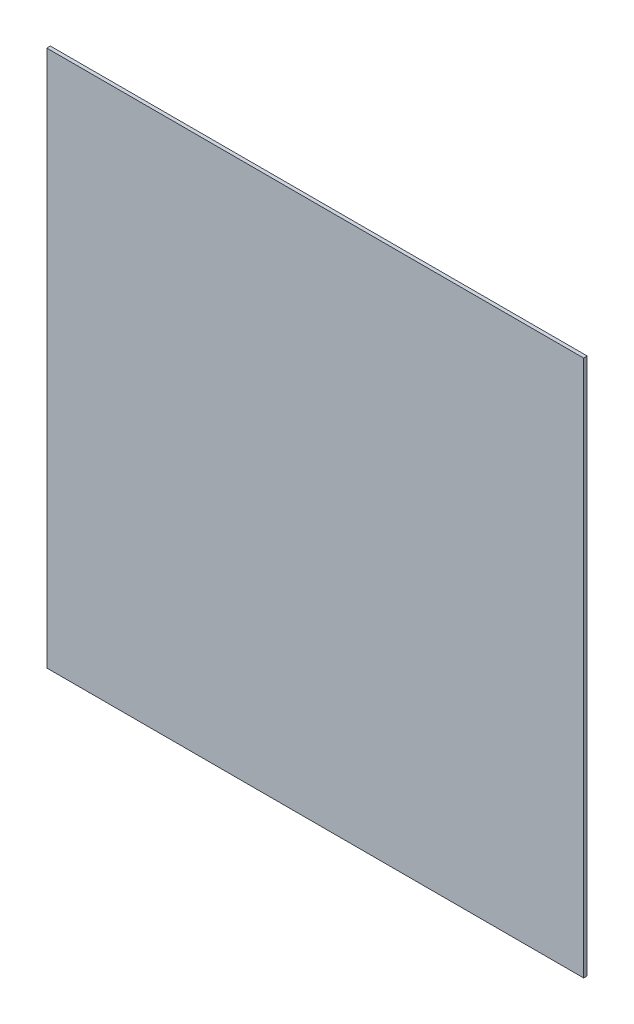
from build123d import *

# Parameters (mm, degrees)
SKETCH_1_W      = 150
SKETCH_1_H      = 150
EXTRUDE_1_DEPTH = 1


with BuildPart() as part:
    # Эскиз1 → Бобышка-Вытянуть1 (new body)
    with BuildSketch(Plane.XY):
        with Locations((75, 75)):
            Rectangle(SKETCH_1_W, SKETCH_1_H)
    extrude(amount=EXTRUDE_1_DEPTH)


solid = part.part
